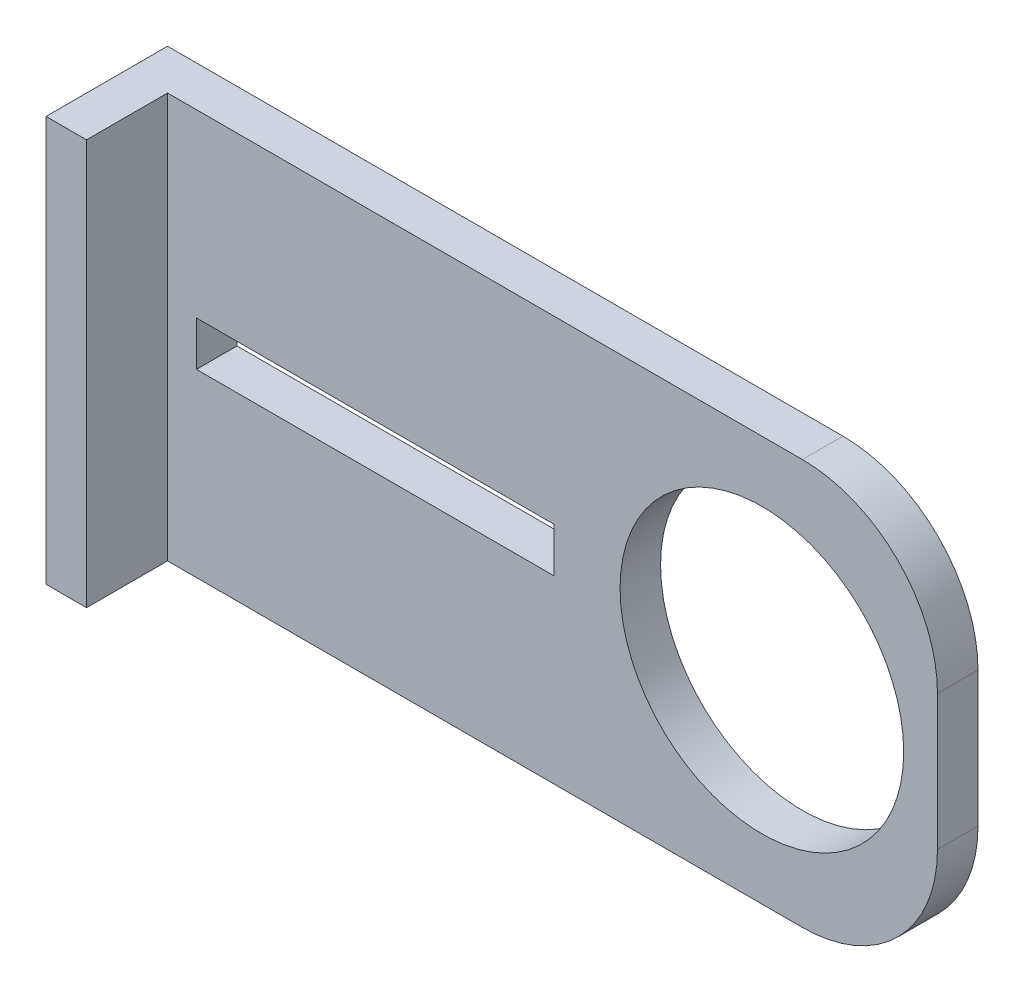
from build123d import *

# Parameters (mm, degrees)
SKETCH_1_W          = 60
SKETCH_1_H          = 30
EXTRUDE_1_DEPTH     = 3
SKETCH_2_W          = 3
SKETCH_2_H          = 30
EXTRUDE_2_DEPTH     = 6
SKETCH_3_R          = 10.5
CUT_EXTRUDE_1_DEPTH = 6
FILLET_1_R          = 10
SKETCH_4_W          = 26.464102696
SKETCH_4_H          = 3.3
CUT_EXTRUDE_2_DEPTH = 6


with BuildPart() as part:
    # 草图1 → 凸台-拉伸1 (new body)
    with BuildSketch(Plane.XY):
        with Locations((30, 15)):
            Rectangle(SKETCH_1_W, SKETCH_1_H)
    extrude(amount=EXTRUDE_1_DEPTH)

    # 草图2 → 凸台-拉伸2 (add)
    with BuildSketch(Plane.XY.offset(3)):
        with Locations((1.5, 15)):
            Rectangle(SKETCH_2_W, SKETCH_2_H)
    extrude(amount=EXTRUDE_2_DEPTH)

    # 草图3 → 切除-拉伸1 (cut)
    with BuildSketch(Plane.XY.offset(3)):
        with Locations((47, 15)):
            Circle(SKETCH_3_R)
    extrude(amount=-CUT_EXTRUDE_1_DEPTH, mode=Mode.SUBTRACT)

    # 圆角1
    fillet_1_edges = [part.edges().sort_by_distance(p)[0] for p in [
        (60, 30, 1.5),
        (60, 0, 1.5),
    ]]
    fillet(fillet_1_edges, radius=FILLET_1_R)

    # 草图4 → 切除-拉伸2 (cut)
    with BuildSketch(Plane.XY.offset(3)):
        with Locations((18.373081002, 15)):
            Rectangle(SKETCH_4_W, SKETCH_4_H)
    extrude(amount=-CUT_EXTRUDE_2_DEPTH, mode=Mode.SUBTRACT)


solid = part.part
